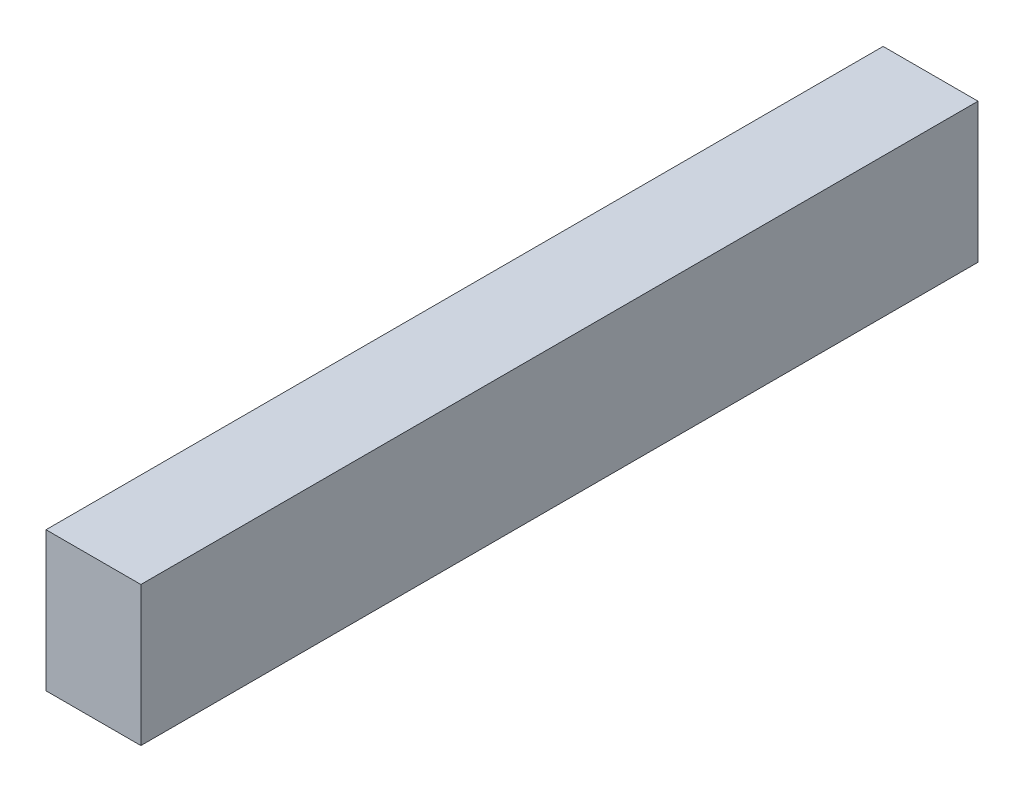
from build123d import *

# Parameters (mm, degrees)
SKETCH1_W           = 34
SKETCH1_H           = 50
BOSS_EXTRUDE1_DEPTH = 300
SKETCH3_W           = 70
SKETCH3_H           = 3
CUT_EXTRUDE1_DEPTH  = 25
SKETCH4_W           = 70
SKETCH4_H           = 4.5
CUT_EXTRUDE2_DEPTH  = 25
SKETCH5_W           = 70
SKETCH5_H           = 5.5
CUT_EXTRUDE3_DEPTH  = 25
SKETCH6_W           = 60
SKETCH6_H           = 20
CUT_EXTRUDE4_DEPTH  = 25
BOSS_EXTRUDE2_DEPTH = 1
BOSS_EXTRUDE3_DEPTH = 1
BOSS_EXTRUDE4_DEPTH = 3


with BuildPart() as part:
    # Sketch1 → Boss-Extrude1 (new body)
    with BuildSketch(Plane.XY):
        Rectangle(SKETCH1_W, SKETCH1_H)
    extrude(amount=BOSS_EXTRUDE1_DEPTH)

    # Sketch3 → Cut-Extrude1 (cut)
    with BuildSketch(Plane.ZY.offset(17)):
        with Locations((255, 0)):
            Rectangle(SKETCH3_W, SKETCH3_H)
    extrude(amount=-CUT_EXTRUDE1_DEPTH, mode=Mode.SUBTRACT)

    # Sketch4 → Cut-Extrude2 (cut)
    with BuildSketch(Plane.ZY.offset(17)):
        with Locations((185, 0)):
            Rectangle(SKETCH4_W, SKETCH4_H)
    extrude(amount=-CUT_EXTRUDE2_DEPTH, mode=Mode.SUBTRACT)

    # Sketch5 → Cut-Extrude3 (cut)
    with BuildSketch(Plane.ZY.offset(17)):
        with Locations((115, 0)):
            Rectangle(SKETCH5_W, SKETCH5_H)
    extrude(amount=-CUT_EXTRUDE3_DEPTH, mode=Mode.SUBTRACT)

    # Sketch6 → Cut-Extrude4 (cut)
    with BuildSketch(Plane.ZY.offset(17)):
        with Locations((30, 0)):
            Rectangle(SKETCH6_W, SKETCH6_H)
        Polygon((60, 10), (80, 2.75), (80, -2.75), (60, -10), align=None)
    extrude(amount=-CUT_EXTRUDE4_DEPTH, mode=Mode.SUBTRACT)

    # Sketch7 → Boss-Extrude2 (add)
    with BuildSketch(Plane(origin=(0, 2.75, 0), x_dir=(-1, 0, 0), z_dir=(0, -1, 0))):
        Polygon((-8, -80), (17, -150), (-8, -150), align=None)
    boss_extrude2 = extrude(amount=BOSS_EXTRUDE2_DEPTH)

    # Sketch9 → Boss-Extrude3 (add)
    with BuildSketch(Plane.XZ.offset(-2.25)):
        Polygon((-17, 220), (8, 220), (8, 150), align=None)
    boss_extrude3 = extrude(amount=BOSS_EXTRUDE3_DEPTH)

    # Sketch10 → Boss-Extrude4 (add)
    with BuildSketch(Plane(origin=(0, 1.5, 0), x_dir=(-1, 0, 0), z_dir=(0, -1, 0))):
        Polygon((17, -290), (-8, -250), (-8, -290), align=None)
    extrude(amount=BOSS_EXTRUDE4_DEPTH)

    # Mirror3: Boss-Extrude2, Boss-Extrude3 across plane
    add(boss_extrude2.mirror(Plane.ZX))
    add(boss_extrude3.mirror(Plane.ZX))


solid = part.part
